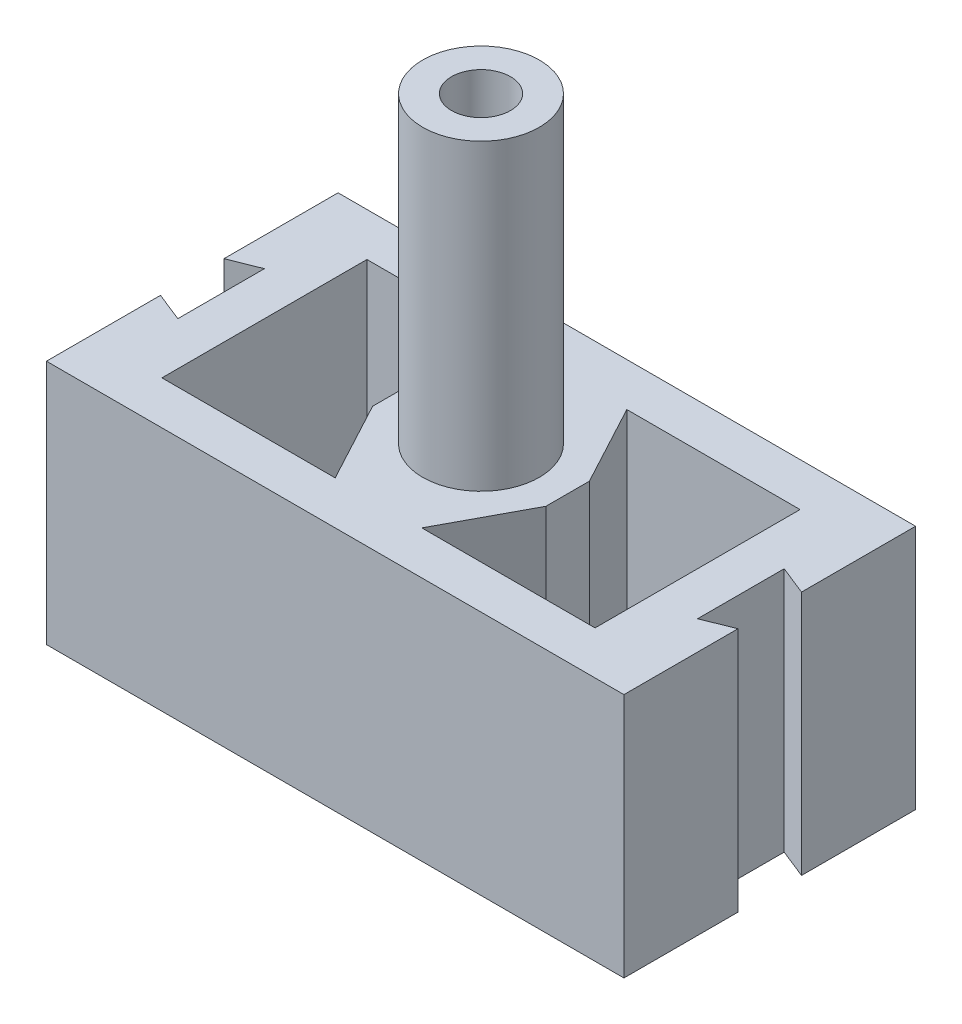
from build123d import *

# Parameters (mm, degrees)
SKETCH1_R           = 3.1
BOSS_EXTRUDE1_DEPTH = 42.5
SKETCH2_R           = 10.1
SKETCH2_R_2         = 5.1
BOSS_EXTRUDE2_DEPTH = 52.5
CUT_EXTRUDE1_DEPTH  = 42.5


with BuildPart() as part:
    # Sketch1 → Boss-Extrude1 (new body)
    with BuildSketch(Plane(origin=(0, 0, 0), x_dir=(1, 0, 0), z_dir=(0, 1, 0))):
        Polygon((-50, 25.25), (-50, 5.5), (-45, 7.5), (-45, -7.5), (-50, -5.5), (-50, -25.25), (50, -25.25), (50, -5.5), (45, -7.5), (45, 7.5), (50, 5.5), (50, 25.25), align=None)
        with Locations(Location((0, 0, 0), (0, 0, 270))):
            Circle(SKETCH1_R, mode=Mode.SUBTRACT)
    extrude(amount=BOSS_EXTRUDE1_DEPTH)

    # Sketch2 → Boss-Extrude2 (add)
    with BuildSketch(Plane(origin=(0, 42.5, 0), x_dir=(1, 0, 0), z_dir=(0, 1, 0))):
        with Locations(Location((0, 0, 0), (0, 0, 270))):
            Circle(SKETCH2_R)
        with Locations(Location((0, 0, 0), (0, 0, 270))):
            Circle(SKETCH2_R_2, mode=Mode.SUBTRACT)
    extrude(amount=BOSS_EXTRUDE2_DEPTH)

    # Sketch3 → Cut-Extrude1 (cut)
    with BuildSketch(Plane(origin=(0, 42.5, 0), x_dir=(1, 0, 0), z_dir=(0, 1, 0))):
        Polygon((-37.5, -17.75), (-37.5, 17.75), (-7.5, 17.75), (-15, 3.769353064), (-15, -3.769353064), (-7.5, -17.75), align=None)
        Polygon((15, -3.769353064), (7.5, -17.75), (37.5, -17.75), (37.5, 17.75), (7.5, 17.75), (15, 3.769353064), align=None)
    extrude(amount=-CUT_EXTRUDE1_DEPTH, mode=Mode.SUBTRACT)


solid = part.part
